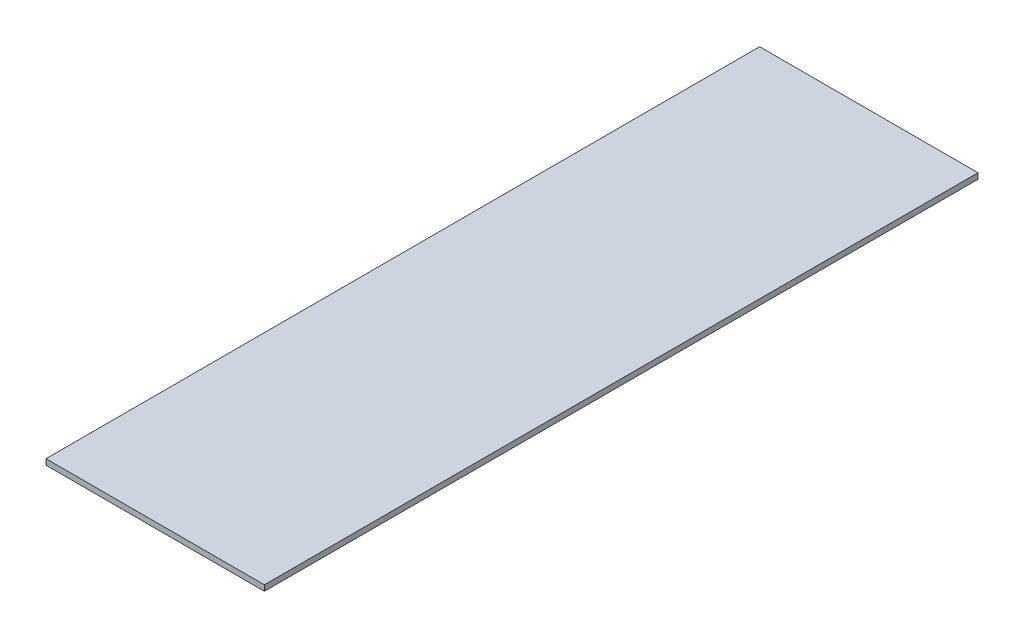
from build123d import *

# Parameters (mm, degrees)
SKETCH2_W           = 174.12
SKETCH2_H           = 569
BOSS_EXTRUDE1_DEPTH = 4.5


with BuildPart() as part:
    # Sketch2 → Boss-Extrude1 (new body)
    with BuildSketch(Plane(origin=(0, 0, 0), x_dir=(1, 0, 0), z_dir=(0, 1, 0))):
        Rectangle(SKETCH2_W, SKETCH2_H)
    extrude(amount=BOSS_EXTRUDE1_DEPTH)


solid = part.part
